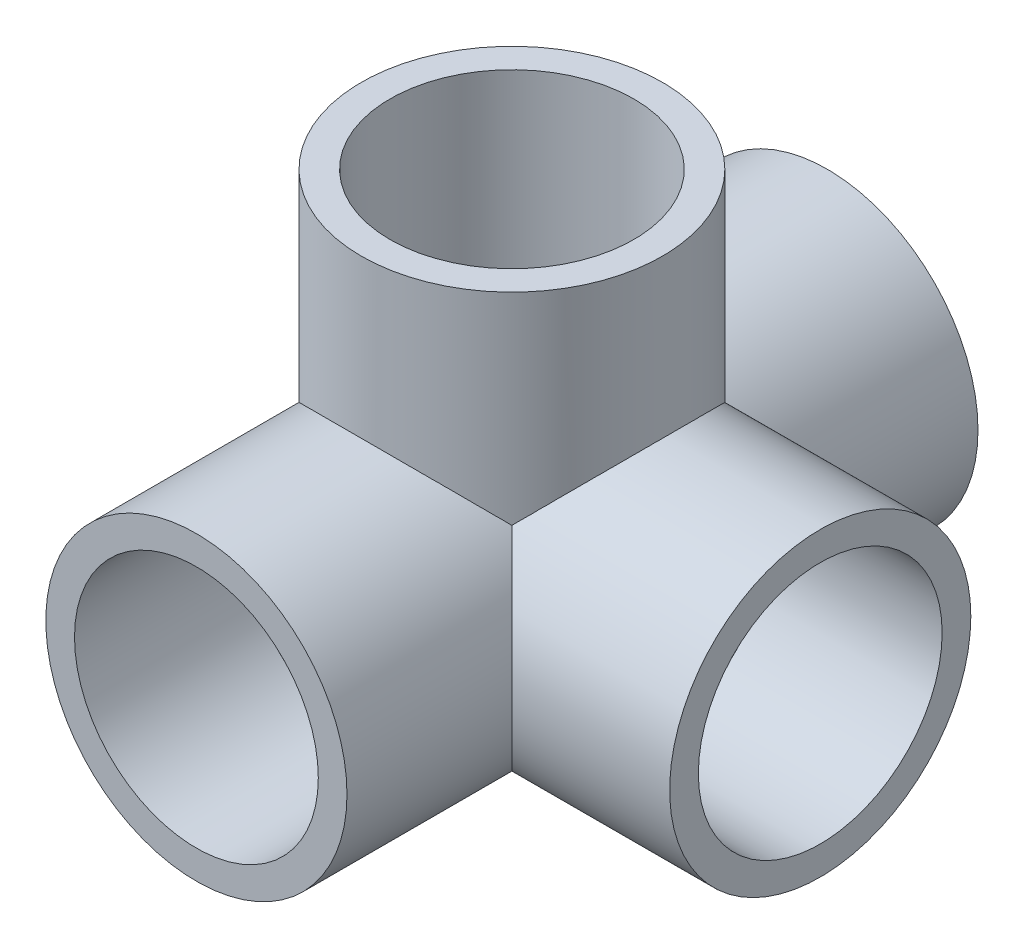
from build123d import *

# Parameters (mm, degrees)
SKETCH1_R           = 16.66875
BOSS_EXTRUDE1_DEPTH = 69.85
SKETCH2_R           = 16.66875
BOSS_EXTRUDE2_DEPTH = 34.13125
SKETCH3_R           = 12.7
CUT_EXTRUDE1_DEPTH  = 30.48
SKETCH5_R           = 12.7
CUT_EXTRUDE3_DEPTH  = 80.509822998
SKETCH7_R           = 13.49375
CUT_EXTRUDE4_DEPTH  = 19.05
SKETCH8_R           = 13.49375
CUT_EXTRUDE5_DEPTH  = 19.05
CUT_EXTRUDE6_START  = -19.05
SKETCH9_R           = 13.49375
CUT_EXTRUDE6_DEPTH  = 19.05
SKETCH10_R          = 16.66875
BOSS_EXTRUDE3_DEPTH = 34.13125
SKETCH11_R          = 12.7
CUT_EXTRUDE7_DEPTH  = 34.13125
SKETCH12_R          = 13.49375
CUT_EXTRUDE8_DEPTH  = 19.05
SKETCH13_R          = 12.7
CUT_EXTRUDE9_DEPTH  = 85.905282368
SKETCH14_R          = 12.7
CUT_EXTRUDE10_DEPTH = 38.1


with BuildPart() as part:
    # Sketch1 → Boss-Extrude1 (new body)
    with BuildSketch(Plane.XY):
        Circle(SKETCH1_R)
    extrude(amount=BOSS_EXTRUDE1_DEPTH)

    # Sketch2 → Boss-Extrude2 (add)
    with BuildSketch(Plane(origin=(0, 0, 0), x_dir=(0, 0, -1), z_dir=(1, 0, 0))):
        with Locations((-34.925, 0)):
            Circle(SKETCH2_R)
    extrude(amount=BOSS_EXTRUDE2_DEPTH)

    # Sketch3 → Cut-Extrude1 (cut)
    with BuildSketch(Plane(origin=(34.13125, 0, 0), x_dir=(0, 0, -1), z_dir=(1, 0, 0))):
        with Locations((-34.925, 0)):
            Circle(SKETCH3_R)
    extrude(amount=-CUT_EXTRUDE1_DEPTH, mode=Mode.SUBTRACT)

    # Sketch5 → Cut-Extrude3 (cut, through all)
    with BuildSketch(Plane(origin=(0, 0, 0), x_dir=(-1, 0, 0), z_dir=(0, 0, -1))):
        Circle(SKETCH5_R)
    extrude(amount=-CUT_EXTRUDE3_DEPTH, mode=Mode.SUBTRACT)

    # Sketch7 → Cut-Extrude4 (cut)
    with BuildSketch(Plane.XY.offset(69.85)):
        Circle(SKETCH7_R)
    extrude(amount=-CUT_EXTRUDE4_DEPTH, mode=Mode.SUBTRACT)

    # Sketch8 → Cut-Extrude5 (cut)
    with BuildSketch(Plane(origin=(34.13125, 0, 0), x_dir=(0, 0, -1), z_dir=(1, 0, 0))):
        with Locations((-34.925, 0)):
            Circle(SKETCH8_R)
    extrude(amount=-CUT_EXTRUDE5_DEPTH, mode=Mode.SUBTRACT)

    # Sketch9 → Cut-Extrude6 (cut)
    with BuildSketch(Plane(origin=(0, 0, 0), x_dir=(-1, 0, 0), z_dir=(0, 0, -1)).offset(CUT_EXTRUDE6_START)):
        with Locations(Location((0, 0, 0), (0, 0, 180))):
            Circle(SKETCH9_R)
    extrude(amount=CUT_EXTRUDE6_DEPTH, mode=Mode.SUBTRACT)


with BuildPart() as body_2:
    # Sketch10 → Boss-Extrude3 (new body)
    with BuildSketch(Plane(origin=(0, 0, 0), x_dir=(1, 0, 0), z_dir=(0, 1, 0))):
        with Locations(Location((0, -34.925, 0), (0, 0, 270))):
            Circle(SKETCH10_R)
    extrude(amount=BOSS_EXTRUDE3_DEPTH)


with BuildPart() as cut_extrude7_tool:
    # Sketch11 → Cut-Extrude7 (new body)
    with BuildSketch(Plane(origin=(0, 34.13125, 0), x_dir=(1, 0, 0), z_dir=(0, 1, 0))):
        with Locations(Location((0, -34.925, 0), (0, 0, 270))):
            Circle(SKETCH11_R)
    extrude(amount=-CUT_EXTRUDE7_DEPTH)


with BuildPart() as part_1:
    add(part.part)

    # Cut-Extrude7: cut by cut_extrude7_tool
    add(cut_extrude7_tool.part, mode=Mode.SUBTRACT)


with BuildPart() as body_2_1:
    add(body_2.part)

    # Cut-Extrude7: cut by cut_extrude7_tool
    add(cut_extrude7_tool.part, mode=Mode.SUBTRACT)


with BuildPart() as cut_extrude8_tool:
    # Sketch12 → Cut-Extrude8 (new body)
    with BuildSketch(Plane(origin=(0, 34.13125, 0), x_dir=(1, 0, 0), z_dir=(0, 1, 0))):
        with Locations(Location((0, -34.925, 0), (0, 0, 270))):
            Circle(SKETCH12_R)
    extrude(amount=-CUT_EXTRUDE8_DEPTH)


with BuildPart() as part_2:
    add(part_1.part)

    # Cut-Extrude8: cut by cut_extrude8_tool
    add(cut_extrude8_tool.part, mode=Mode.SUBTRACT)


with BuildPart() as body_2_2:
    add(body_2_1.part)

    # Cut-Extrude8: cut by cut_extrude8_tool
    add(cut_extrude8_tool.part, mode=Mode.SUBTRACT)

    # Sketch13 → Cut-Extrude9 (cut, through all)
    with BuildSketch(Plane(origin=(0, 0, 0), x_dir=(-1, 0, 0), z_dir=(0, 0, -1))):
        Circle(SKETCH13_R)
    extrude(amount=-CUT_EXTRUDE9_DEPTH, mode=Mode.SUBTRACT)


with BuildPart() as cut_extrude10_tool:
    # Sketch14 → Cut-Extrude10 (new body)
    with BuildSketch(Plane(origin=(34.13125, 0, 0), x_dir=(0, 0, -1), z_dir=(1, 0, 0))):
        with Locations((-34.925, 0)):
            Circle(SKETCH14_R)
    extrude(amount=-CUT_EXTRUDE10_DEPTH)


with BuildPart() as part_3:
    add(part_2.part)

    # Cut-Extrude10: cut by cut_extrude10_tool
    add(cut_extrude10_tool.part, mode=Mode.SUBTRACT)


with BuildPart() as body_2_3:
    add(body_2_2.part)

    # Cut-Extrude10: cut by cut_extrude10_tool
    add(cut_extrude10_tool.part, mode=Mode.SUBTRACT)


solid = Compound([part_3.part, body_2_3.part])
